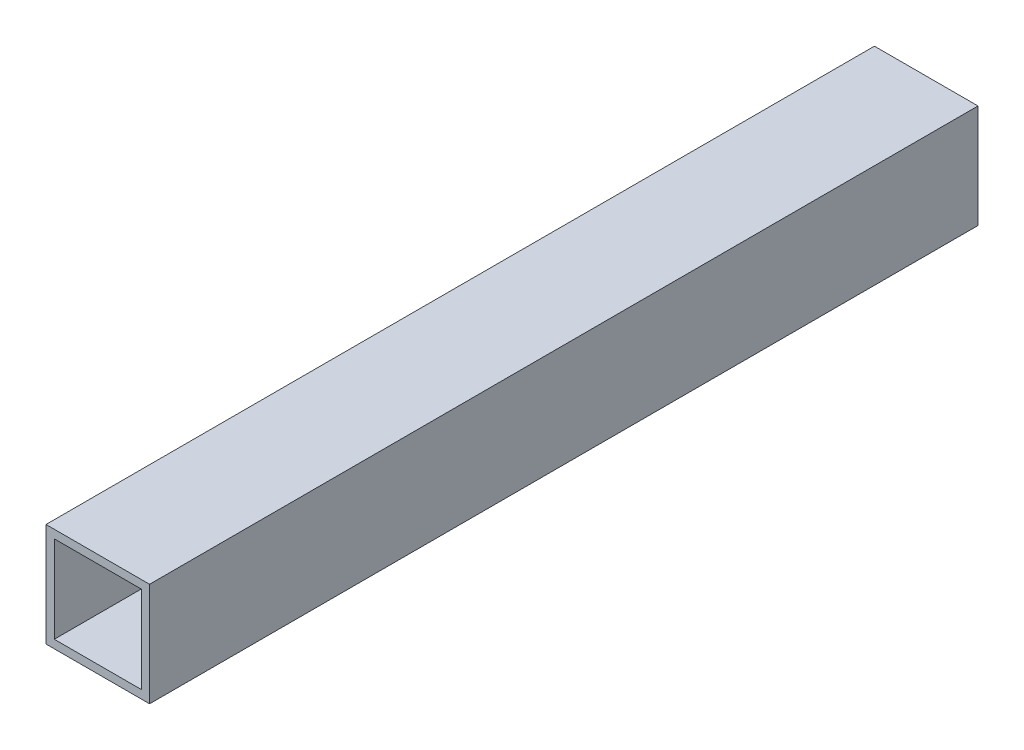
from build123d import *

# Parameters (mm, degrees)
SKETCH1_W           = 25
SKETCH1_H           = 25
SKETCH1_W_2         = 21
SKETCH1_H_2         = 21
BOSS_EXTRUDE1_DEPTH = 200


with BuildPart() as part:
    # Sketch1 → Boss-Extrude1 (new body)
    with BuildSketch(Plane.XY):
        Rectangle(SKETCH1_W, SKETCH1_H)
        Rectangle(SKETCH1_W_2, SKETCH1_H_2, mode=Mode.SUBTRACT)
    extrude(amount=BOSS_EXTRUDE1_DEPTH)


solid = part.part
